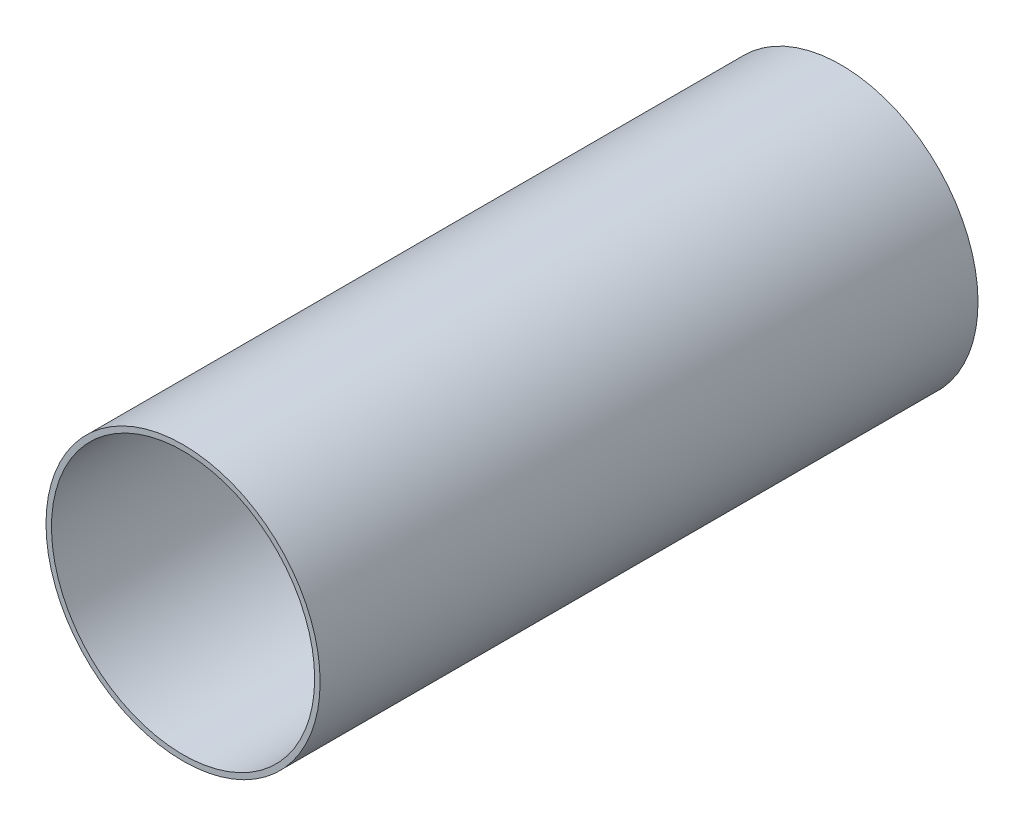
from build123d import *

# Parameters (mm, degrees)
ESQUISSE1_R             = 25
ESQUISSE1_R_2           = 24
EXTRU_MINCE1_DEPTH      = 120
ESQUISSE2_W             = 30
ESQUISSE2_H             = 40
ENL_V_MAT_EXTRU_1_DEPTH = 126.099960032


with BuildPart() as part:
    # Esquisse1 → Extru.-Mince1 (new body)
    with BuildSketch(Plane.XY):
        Circle(ESQUISSE1_R)
        Circle(ESQUISSE1_R_2, mode=Mode.SUBTRACT)
    extrude(amount=EXTRU_MINCE1_DEPTH)

    # Esquisse2 → Enlèv. mat.-Extru.1 (cut, through all)
    with BuildSketch(Plane(origin=(0, 0, 0), x_dir=(1, 0, 0), z_dir=(0, 1, 0))):
        with Locations((0, -20)):
            Rectangle(ESQUISSE2_W, ESQUISSE2_H)
    extrude(amount=-ENL_V_MAT_EXTRU_1_DEPTH, mode=Mode.SUBTRACT)


solid = part.part
